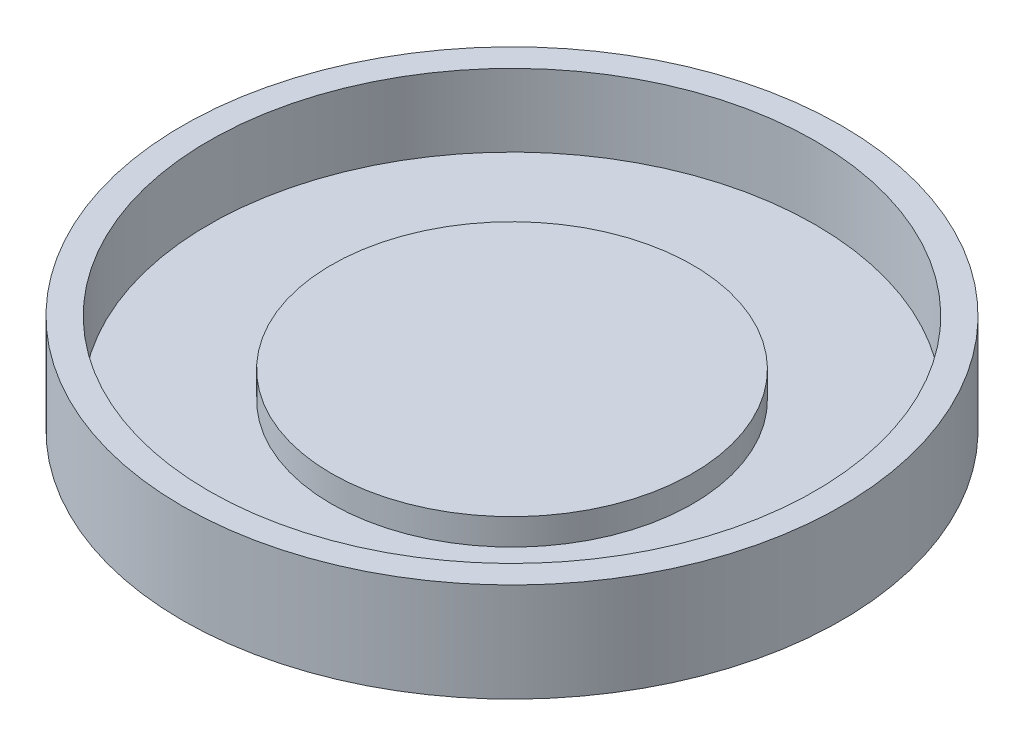
from build123d import *

# Parameters (mm, degrees)
SKETCH1_R           = 50
BOSS_EXTRUDE2_DEPTH = 15
SHELL1_T            = -4
SKETCH3_R           = 27.405
BOSS_EXTRUDE3_DEPTH = 4


with BuildPart() as part:
    # Sketch1 → Boss-Extrude2 (new body)
    with BuildSketch(Plane(origin=(0, 0, 0), x_dir=(1, 0, 0), z_dir=(0, 1, 0))):
        with Locations(Location((0, 0, 0), (0, 0, 270))):
            Circle(SKETCH1_R)
    extrude(amount=BOSS_EXTRUDE2_DEPTH)

    # Shell1
    shell1_openings = [part.faces().sort_by_distance(p)[0] for p in [
        (0, 15, 0),
    ]]
    offset(amount=SHELL1_T, openings=shell1_openings, kind=Kind.INTERSECTION)

    # Sketch3 → Boss-Extrude3 (add)
    with BuildSketch(Plane(origin=(0, 4, 0), x_dir=(1, 0, 0), z_dir=(0, 1, 0))):
        with Locations(Location((0, 0, 0), (0, 0, 270))):
            Circle(SKETCH3_R)
    extrude(amount=BOSS_EXTRUDE3_DEPTH)


solid = part.part
